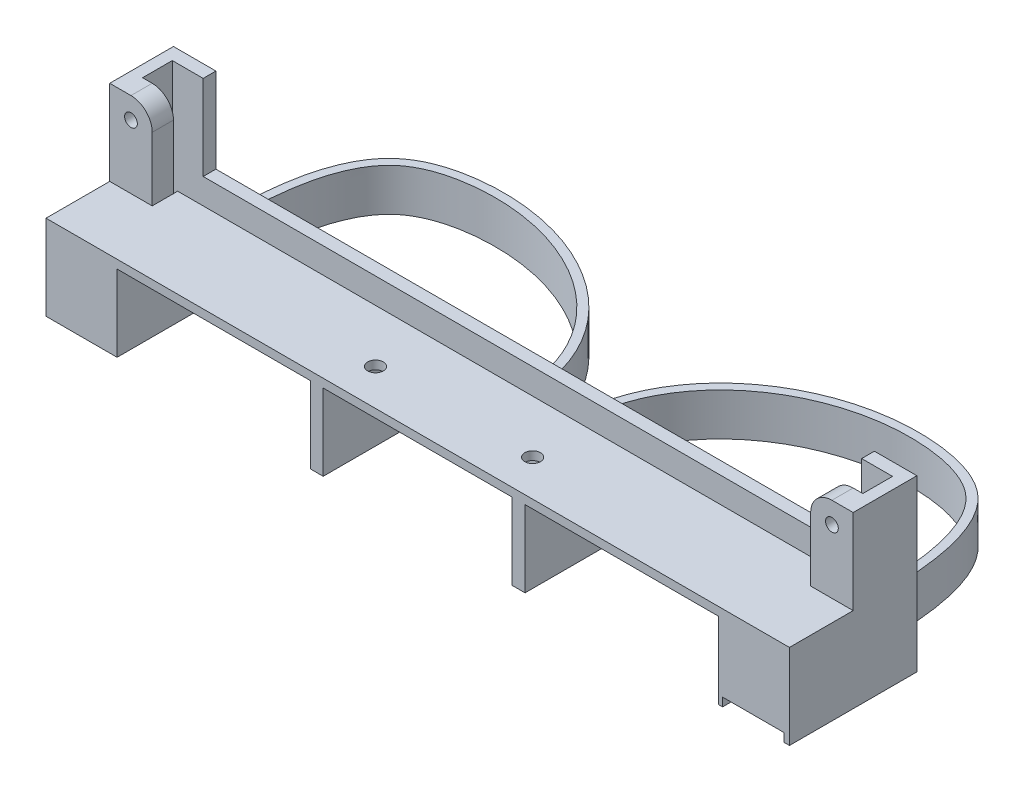
from build123d import *

# Parameters (mm, degrees)
EXTRUDE_424_DEPTH      = 20
SKETCH_9_W             = 44.5
SKETCH_9_H             = 20
SKETCH_9_W_2           = 45.5
IR_DEPTH               = 18
SKETCH_10_W            = 10
SKETCH_10_H            = 20
EXTRUDE_4_DEPTH        = 10
SKETCH_11_W            = 10
SKETCH_11_H            = 20
EXTRUDE_5_DEPTH        = 10
SKETCH_12_R            = 1.85
IR_2_DEPTH             = 10
SKETCH_15_W            = 6
SKETCH_15_H            = 15
CUT_EXTRUDE_2222_DEPTH = 171.181132046
SKETCH_13_W            = 10.882520515
SKETCH_13_H            = 7.2
IR_3_DEPTH             = 1
SKETCH_16_W            = 24.541962537
SKETCH_16_H            = 2.470190362
CUT_EXTRUDE_1_DEPTH    = 1
SKETCH_17_W            = 34.283405153
SKETCH_17_H            = 3.253435469
CUT_EXTRUDE_2_DEPTH    = 1
SKETCH_18_W            = 14.5
SKETCH_18_H            = 20
BH1750_DEPTH           = 2
SKETCH_19_W            = 13.126104065
SKETCH_19_H            = 3.881549914
BH1759_1_DEPTH         = 10
SKETCH_25_W            = 10
SKETCH_25_H            = 5
EXTRUDE_6_DEPTH        = 10
SKETCH_28_W            = 10
SKETCH_28_H            = 5
EXTRUDE_7_DEPTH        = 10
SKETCH_29_W            = 12.5
SKETCH_29_H            = 6
CUT_EXTRUDE_1_2_DEPTH  = 5
SKETCH_8_R             = 1.5
EXTRUDE_9_DEPTH        = 5
EXTRUDE_10_DEPTH       = 10
EXTRUDE_10_2_DEPTH     = 10
EXTRUDE_11_DEPTH       = 35
EXTRUDE_12_DEPTH       = 35
SKETCH_33_W            = 4.396057752
SKETCH_33_H            = 3.541501354
CUT_EXTRUDE_15_DEPTH   = 4


with BuildPart() as part:
    # 草图6 → Extrude 424 (new body)
    with BuildSketch(Plane(origin=(0, 0, 0), x_dir=(1, 0, 0), z_dir=(0, 1, 0))):
        Polygon((-77.559782609, -16.559782609), (-77.559782609, -26.559782609), (-67.559782609, -26.559782609), (-67.559782609, -36.559782609), (87.440217391, -36.559782609), (87.440217391, -26.559782609), (97.440217391, -26.559782609), (97.440217391, -16.559782609), (87.440217391, -16.559782609), (87.440217391, -6.559782609), (-67.559782609, -6.559782609), (-67.559782609, -16.559782609), align=None)
    extrude(amount=EXTRUDE_424_DEPTH)

    # 草图9 → ir (cut)
    with BuildSketch(Plane.XZ):
        with Locations((9.940217391, 26.559782609)):
            Rectangle(SKETCH_9_W, SKETCH_9_H)
        with Locations((57.955553821, 26.559782609)):
            Rectangle(SKETCH_9_W_2, SKETCH_9_H)
        with Locations((-38.075119038, 26.559782609)):
            Rectangle(SKETCH_9_W_2, SKETCH_9_H)
    extrude(amount=-IR_DEPTH, mode=Mode.SUBTRACT)

    # 草图10 → 凸台-拉伸4 (add)
    with BuildSketch(Plane.XY.offset(26.559782609)):
        with Locations((92.440217391, 10)):
            Rectangle(SKETCH_10_W, SKETCH_10_H)
    extrude(amount=EXTRUDE_4_DEPTH)

    # 草图11 → 凸台-拉伸5 (add)
    with BuildSketch(Plane.XY.offset(26.559782609)):
        with Locations((-72.559782609, 10)):
            Rectangle(SKETCH_11_W, SKETCH_11_H)
    extrude(amount=EXTRUDE_5_DEPTH)

    # 草图12 → IR 2 (cut)
    with BuildSketch(Plane.XZ.offset(-18)):
        with Locations(Location((-8.559782609, 28.007356634, 0), (0, 0, 270))):
            Circle(SKETCH_12_R)
        with Locations(Location((28.440217391, 28.007356634, 0), (0, 0, 270))):
            Circle(SKETCH_12_R)
    extrude(amount=-IR_2_DEPTH, mode=Mode.SUBTRACT)

    # 草图15 → Cut-Extrude 2222 (cut, through all)
    with BuildSketch(Plane(origin=(87.440217391, 0, 0), x_dir=(0, 0, -1), z_dir=(1, 0, 0))):
        with Locations((-12.559782609, 12.5)):
            Rectangle(SKETCH_15_W, SKETCH_15_H)
    extrude(amount=-CUT_EXTRUDE_2222_DEPTH, mode=Mode.SUBTRACT)

    # 草图13 → ir 3 (cut)
    with BuildSketch(Plane.XY.offset(16.559782609)):
        with Locations((9.887839431, 10.374814022)):
            Rectangle(SKETCH_13_W, SKETCH_13_H)
    extrude(amount=-IR_3_DEPTH, mode=Mode.SUBTRACT)

    # 草图16 → Cut-Extrude 1 (cut)
    with BuildSketch(Plane.XY.offset(16.559782609)):
        with Locations((-39.68528849, 15.361228101)):
            Rectangle(SKETCH_16_W, SKETCH_16_H)
    extrude(amount=-CUT_EXTRUDE_1_DEPTH, mode=Mode.SUBTRACT)

    # 草图17 → 超声2接线孔 (cut)
    with BuildSketch(Plane.XY.offset(16.559782609)):
        with Locations((57.869979923, 15.004366633)):
            Rectangle(SKETCH_17_W, SKETCH_17_H)
    extrude(amount=-CUT_EXTRUDE_2_DEPTH, mode=Mode.SUBTRACT)

    # 草图18 → BH1750_前_固定孔 (cut)
    with BuildSketch(Plane.XZ):
        with Locations((88.955553821, 26.559782609)):
            Rectangle(SKETCH_18_W, SKETCH_18_H)
    extrude(amount=-BH1750_DEPTH, mode=Mode.SUBTRACT)

    # 草图19 → BH1759排线槽1 (cut)
    with BuildSketch(Plane.XZ.offset(-2)):
        with Locations((89.084488571, 19.052159055)):
            Rectangle(SKETCH_19_W, SKETCH_19_H)
    extrude(amount=-BH1759_1_DEPTH, mode=Mode.SUBTRACT)

    # 草图25 → 凸台-拉伸6 (add)
    with BuildSketch(Plane(origin=(0, 0, 16.559782609), x_dir=(-1, 0, 0), z_dir=(0, 0, -1))):
        with Locations((-92.440217391, 2.5)):
            Rectangle(SKETCH_25_W, SKETCH_25_H)
    extrude(amount=EXTRUDE_6_DEPTH)

    # 草图28 → 凸台-拉伸7 (add)
    with BuildSketch(Plane(origin=(0, 0, 16.559782609), x_dir=(-1, 0, 0), z_dir=(0, 0, -1))):
        with Locations((72.559782609, 2.5)):
            Rectangle(SKETCH_28_W, SKETCH_28_H)
    extrude(amount=EXTRUDE_7_DEPTH)

    # 草图29 → Cut-Extrude 1 2 (cut)
    with BuildSketch(Plane.XZ):
        with Locations((-39.530153737, 12.559782609)):
            Rectangle(SKETCH_29_W, SKETCH_29_H)
        with Locations((59.410217391, 12.559782609)):
            Rectangle(SKETCH_29_W, SKETCH_29_H)
    extrude(amount=-CUT_EXTRUDE_1_2_DEPTH, mode=Mode.SUBTRACT)

    # 草图8 → 凸台-拉伸9 (add)
    # profile 1 of 2: a face of its own
    with BuildSketch(Plane(origin=(0, 0, 16.559782609), x_dir=(-1, 0, 0), z_dir=(0, 0, -1))):
        with BuildLine():
            Line((-87.440217391, 20), (-97.440217391, 20))
            Line((-97.440217391, 20), (-97.440217391, 40))
            Line((-97.440217391, 40), (-92.440217391, 40))
            ThreePointArc((-92.440217391, 40), (-88.904683485, 38.535533906), (-87.440217391, 35))
            Line((-87.440217391, 35), (-87.440217391, 20))
        make_face()
        with Locations((-92.440217391, 35)):
            Circle(SKETCH_8_R, mode=Mode.SUBTRACT)
    # profile 2 of 2: a face of its own
    with BuildSketch(Plane(origin=(0, 0, 16.559782609), x_dir=(-1, 0, 0), z_dir=(0, 0, -1))):
        with BuildLine():
            Line((67.559782609, 20), (67.559782609, 35))
            ThreePointArc((67.559782609, 35), (69.024248703, 38.535533906), (72.559782609, 40))
            Line((72.559782609, 40), (77.559782609, 40))
            Line((77.559782609, 40), (77.559782609, 20))
            Line((77.559782609, 20), (67.559782609, 20))
        make_face()
        with Locations(Location((72.559782609, 35, 0), (0, 0, 180))):
            Circle(SKETCH_8_R, mode=Mode.SUBTRACT)
    extrude(amount=-EXTRUDE_9_DEPTH)



with BuildPart() as body_2:
    # 草图30 → 凸台-拉伸10 (new body)
    with BuildSketch(Plane.XZ):
        with BuildLine():
            Line((-65.559782609, 6.559782609), (-67.559782609, 6.559782609))
            add(Edge.make_bspline(
                [(-67.559782609, 6.559782609), (-67.559782615, -2.831750368), (-66.951063879, -26.693920993), (-25.547228665, -38.442302875), (5.320217293, -18.58086721), (5.320217391, 6.559782609)],
                knots=[0, 0, 0, 0, 0.293331619, 0.430027762, 1, 1, 1, 1], degree=3))
            Line((5.320217391, 6.559782609), (3.320217391, 6.559782609))
            add(Edge.make_bspline(
                [(-65.559782609, 6.559782607), (-65.559782609, 6.045118096), (-65.557439516, 5.039817519), (-65.534390428, 2.837044533), (-65.454379934, -0.102082601), (-65.223267199, -3.857669351), (-64.665969093, -8.998959682), (-63.375409887, -15.390627267), (-60.997478567, -20.916717154), (-58.343812027, -24.378581092), (-55.136170725, -27.10192273), (-49.835817329, -29.402048854), (-42.346097069, -30.591796275), (-34.792946451, -30.541405828), (-27.378683065, -29.295677263), (-20.312173541, -26.930867488), (-13.800925165, -23.521784965), (-8.048578767, -19.149967972), (-3.250641537, -13.89816626), (-0.201141288, -8.853589574), (1.581132972, -4.447061116), (2.566885134, -0.963022362), (3.076523936, 2.089934189), (3.284766561, 4.611805642), (3.320217389, 5.913625911), (3.320217391, 6.559782617)],
                knots=[0, 0, 0, 0, 0.015625, 0.03125, 0.0625, 0.09375, 0.125, 0.1875, 0.25, 0.28125, 0.3125, 0.375, 0.4375, 0.5, 0.5625, 0.625, 0.6875, 0.75, 0.8125, 0.875, 0.90625, 0.9375, 0.96875, 0.984375, 1, 1, 1, 1], degree=3))
        make_face()
    extrude(amount=-EXTRUDE_10_DEPTH)


with BuildPart() as body_3:
    # 草图30 → Extrude 10 2 (new body)
    with BuildSketch(Plane.XZ):
        with BuildLine():
            Line((16.560217391, 6.559782609), (14.560217391, 6.559782609))
            add(Edge.make_bspline(
                [(87.440217391, 6.559782609), (87.440217398, -2.831750368), (86.831498662, -26.693920993), (45.427663448, -38.442302875), (14.56021749, -18.58086721), (14.560217391, 6.559782609)],
                knots=[0, 0, 0, 0, 0.293331619, 0.430027762, 1, 1, 1, 1], degree=3))
            Line((87.440217391, 6.559782609), (85.440217391, 6.559782609))
            add(Edge.make_bspline(
                [(85.440217391, 6.559782607), (85.440217392, 6.045118096), (85.437874299, 5.039817519), (85.41482521, 2.837044533), (85.334814717, -0.102082601), (85.103701982, -3.857669351), (84.546403875, -8.998959682), (83.25584467, -15.390627267), (80.87791335, -20.916717154), (78.224246809, -24.378581092), (75.016605508, -27.10192273), (69.716252112, -29.402048854), (62.226531852, -30.591796275), (54.673381234, -30.541405828), (47.259117848, -29.295677263), (40.192608324, -26.930867488), (33.681359948, -23.521784965), (27.92901355, -19.149967972), (23.13107632, -13.89816626), (20.08157607, -8.853589574), (18.29930181, -4.447061116), (17.313549649, -0.963022362), (16.803910846, 2.089934189), (16.595668222, 4.611805642), (16.560217394, 5.913625911), (16.560217391, 6.559782617)],
                knots=[0, 0, 0, 0, 0.015625, 0.03125, 0.0625, 0.09375, 0.125, 0.1875, 0.25, 0.28125, 0.3125, 0.375, 0.4375, 0.5, 0.5625, 0.625, 0.6875, 0.75, 0.8125, 0.875, 0.90625, 0.9375, 0.96875, 0.984375, 1, 1, 1, 1], degree=3))
        make_face()
    extrude(amount=-EXTRUDE_10_2_DEPTH)


with BuildPart() as part_1:
    add(part.part)

    add(body_3.part)  # 凸台-拉伸11 merges body 3
    # 草图31 → 凸台-拉伸11 (add)
    with BuildSketch(Plane(origin=(0, 5, 0), x_dir=(1, 0, 0), z_dir=(0, 1, 0))):
        Polygon((87.440217391, -6.559782609), (87.440217391, -9.559782609), (94.710697122, -9.559782609), (94.710697122, -16.559782609), (97.440217391, -16.559782609), (97.440217391, -6.559782609), align=None)
    extrude(amount=EXTRUDE_11_DEPTH)


    add(body_2.part)  # 凸台-拉伸12 merges body 2
    # 草图32 → 凸台-拉伸12 (add)
    with BuildSketch(Plane(origin=(0, 5, 0), x_dir=(1, 0, 0), z_dir=(0, 1, 0))):
        Polygon((-67.559782609, -6.559782609), (-67.559782609, -9.559782609), (-74.829782609, -9.559782609), (-74.829782609, -16.559782609), (-77.559782609, -16.559782609), (-77.559782609, -6.559782609), align=None)
    extrude(amount=EXTRUDE_12_DEPTH)

    # 草图33 → 切除-拉伸15 (cut)
    with BuildSketch(Plane.XY.offset(17.111384098)):
        with Locations((84.719465414, 10.229249323)):
            Rectangle(SKETCH_33_W, SKETCH_33_H)
    extrude(amount=-CUT_EXTRUDE_15_DEPTH, mode=Mode.SUBTRACT)


solid = part_1.part
